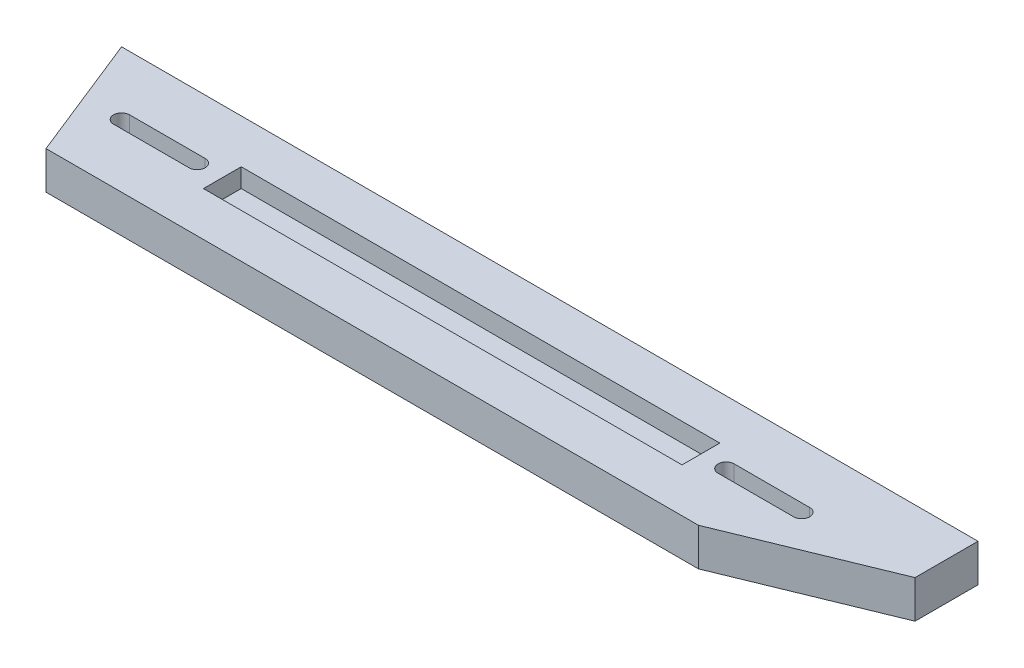
from build123d import *

# Parameters (mm, degrees)
SKETCH1_W           = 431.8
SKETCH1_H           = 63.5
BOSS_EXTRUDE1_DEPTH = 19.05
CUT_EXTRUDE2_DEPTH  = 220.051991545
CUT_EXTRUDE1_DEPTH  = 19.05
SKETCH5_W           = 241.3
SKETCH5_H           = 19.05
CUT_EXTRUDE3_DEPTH  = 9.525


with BuildPart() as part:
    # Sketch1 → Boss-Extrude1 (new body)
    with BuildSketch(Plane(origin=(0, 0, 0), x_dir=(1, 0, 0), z_dir=(0, 1, 0))):
        Rectangle(SKETCH1_W, SKETCH1_H)
    extrude(amount=BOSS_EXTRUDE1_DEPTH)

    # Sketch3 → Cut-Extrude2 (cut, through all)
    with BuildSketch(Plane(origin=(0, 19.05, 0), x_dir=(1, 0, 0), z_dir=(0, 1, 0))):
        Polygon((-215.9, 31.75), (-190.5, -31.75), (-215.9, -31.75), align=None)
        Polygon((215.9, 0), (138.43, -31.75), (215.9, -31.75), align=None)
    extrude(amount=-CUT_EXTRUDE2_DEPTH, mode=Mode.SUBTRACT)

    # Sketch2 → Cut-Extrude1 (cut)
    with BuildSketch(Plane(origin=(0, 19.05, 0), x_dir=(1, 0, 0), z_dir=(0, 1, 0))):
        with BuildLine():
            Line((158.75, -4.064), (120.65, -4.064))
            ThreePointArc((120.65, -4.064), (116.586, 0), (120.65, 4.064))
            Line((120.65, 4.064), (158.75, 4.064))
            ThreePointArc((158.75, 4.064), (162.814, 0), (158.75, -4.064))
        make_face()
        with BuildLine():
            Line((-184.15, 4.064), (-146.05, 4.064))
            ThreePointArc((-146.05, 4.064), (-141.986, 0), (-146.05, -4.064))
            Line((-146.05, -4.064), (-184.15, -4.064))
            ThreePointArc((-184.15, -4.064), (-188.214, 0), (-184.15, 4.064))
        make_face()
    extrude(amount=-CUT_EXTRUDE1_DEPTH, mode=Mode.SUBTRACT)

    # Sketch5 → Cut-Extrude3 (cut)
    with BuildSketch(Plane(origin=(0, 19.05, 0), x_dir=(1, 0, 0), z_dir=(0, 1, 0))):
        with Locations((-12.7, 0)):
            Rectangle(SKETCH5_W, SKETCH5_H)
    extrude(amount=-CUT_EXTRUDE3_DEPTH, mode=Mode.SUBTRACT)


solid = part.part
